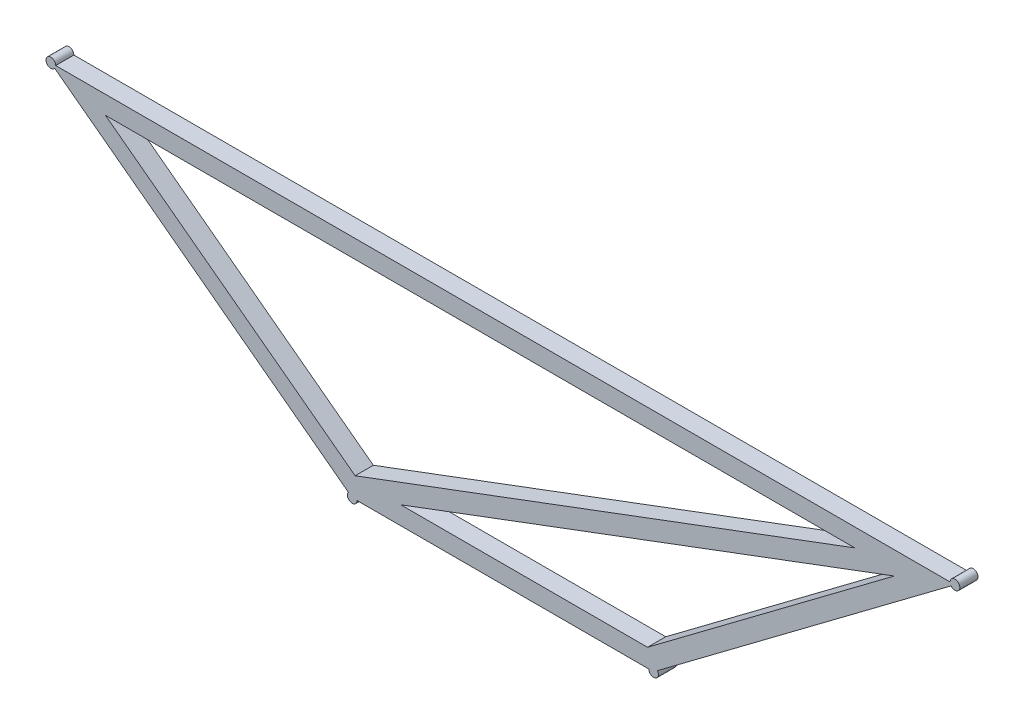
from build123d import *

# Parameters (mm, degrees)
BOSS_EXTRUDE1_DEPTH = 24.14


with BuildPart() as part:
    # Sketch3 → Boss-Extrude1 (new body)
    with BuildSketch(Plane.XY):
        with BuildLine():
            Line((6.42, 0), (393.58, 0))
            ThreePointArc((393.58, 0), (402.030182258, -6.090546773), (405.136, 3.852))
            Line((405.136, 3.852), (794.864, 296.148))
            ThreePointArc((794.864, 296.148), (806.090546773, 302.030182258), (793.58, 300))
            Line((793.58, 300), (-393.58, 300))
            ThreePointArc((-393.58, 300), (-406.090546773, 302.030182258), (-394.864, 296.148))
            Line((-394.864, 296.148), (-5.136, 3.852))
            ThreePointArc((-5.136, 3.852), (-2.030182258, -6.090546773), (6.42, 0))
        make_face()
        Polygon((64.373333333, 24.14), (719.533333333, 269.825), (391.953333333, 24.14), align=None, mode=Mode.SUBTRACT)
        Polygon((-327.58, 275.86), (3.90530551, 27.246020868), (666.875916529, 275.86), align=None, mode=Mode.SUBTRACT)
    extrude(amount=BOSS_EXTRUDE1_DEPTH)


solid = part.part
